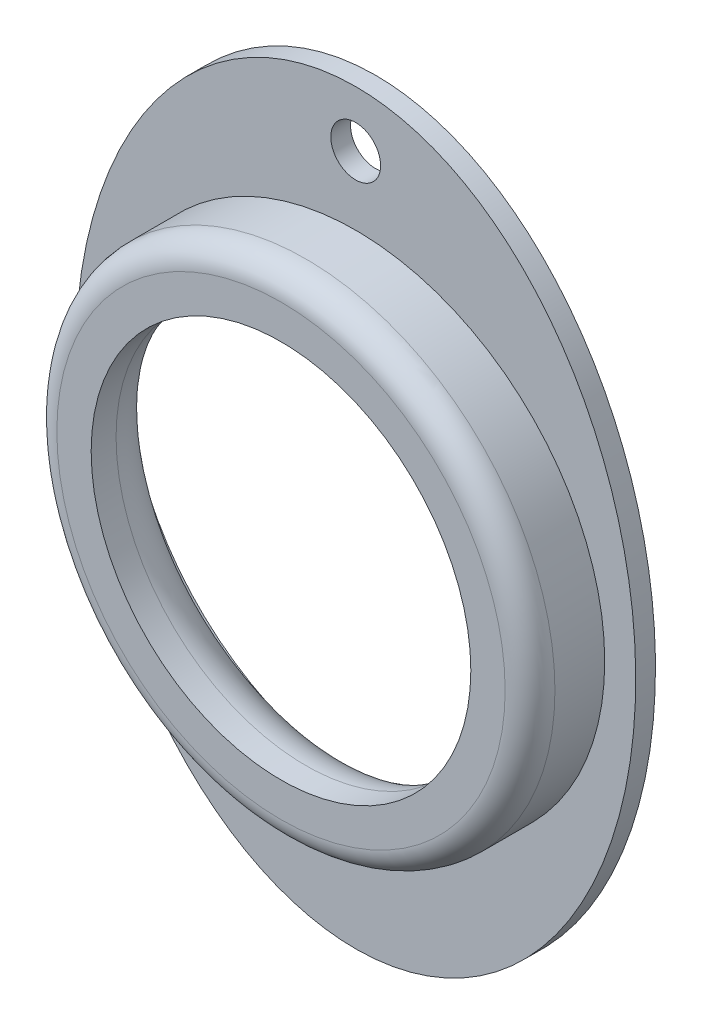
from build123d import *

# Parameters (mm, degrees)
SKETCH1_R               = 20.008311299
BOSS_EXTRUDE1_DEPTH     = 1.5875
SKETCH1_3_R             = 20.008311299
SKETCH1_3_R_2           = 15.25098722
BOSS_EXTRUDE2_DEPTH     = 6
FILLET1_R               = 4
FILLET2_R               = 2
CUT_EXTRUDE1_DEPTH      = 39.259902878
CUT_EXTRUDE1_DEPTH_BACK = 39.259902878
SKETCH3_R               = 2


with BuildPart() as part:
    # Sketch1 → Boss-Extrude1 (new body)
    with BuildSketch(Plane.XY):
        with BuildLine():
            add(Edge.make_bspline(
                [(0, 30), (-38.97114317, 30), (-19.485571585, -15), (0, -60), (19.485571585, -15), (38.97114317, 30), (0, 30)],
                knots=[0, 0, 0, 2.094395102, 2.094395102, 4.188790205, 4.188790205, 6.283185307, 6.283185307, 6.283185307], degree=2, weights=[1, 0.5, 1, 0.5, 1, 0.5, 1]))
        make_face()
        Circle(SKETCH1_R, mode=Mode.SUBTRACT)
    extrude(amount=-BOSS_EXTRUDE1_DEPTH)

    # Sketch3 → Cut-Extrude1 (cut, two sides: drawn at the far end of the back side and taken through both)
    with BuildSketch(Plane(origin=(0, 0, -1.5875), x_dir=(-1, 0, 0), z_dir=(0, 0, -1)).offset(-CUT_EXTRUDE1_DEPTH_BACK)):
        with Locations((0, 25.5)):
            Circle(SKETCH3_R)
    extrude(amount=CUT_EXTRUDE1_DEPTH + CUT_EXTRUDE1_DEPTH_BACK, mode=Mode.SUBTRACT)


with BuildPart() as body_2:
    # Sketch1<3> → Boss-Extrude2 (new body)
    with BuildSketch(Plane.XY):
        Circle(SKETCH1_3_R)
        Circle(SKETCH1_3_R_2, mode=Mode.SUBTRACT)
    extrude(amount=BOSS_EXTRUDE2_DEPTH)

    # Fillet1
    fillet1_edges = [body_2.edges().sort_by_distance(p)[0] for p in [
        (-15.25098722, 0, 0),
    ]]
    fillet(fillet1_edges, radius=FILLET1_R)

    # Fillet2
    fillet2_edges = [body_2.edges().sort_by_distance(p)[0] for p in [
        (-20.008311299, 0, 6),
    ]]
    fillet(fillet2_edges, radius=FILLET2_R)


solid = Compound([part.part, body_2.part])
